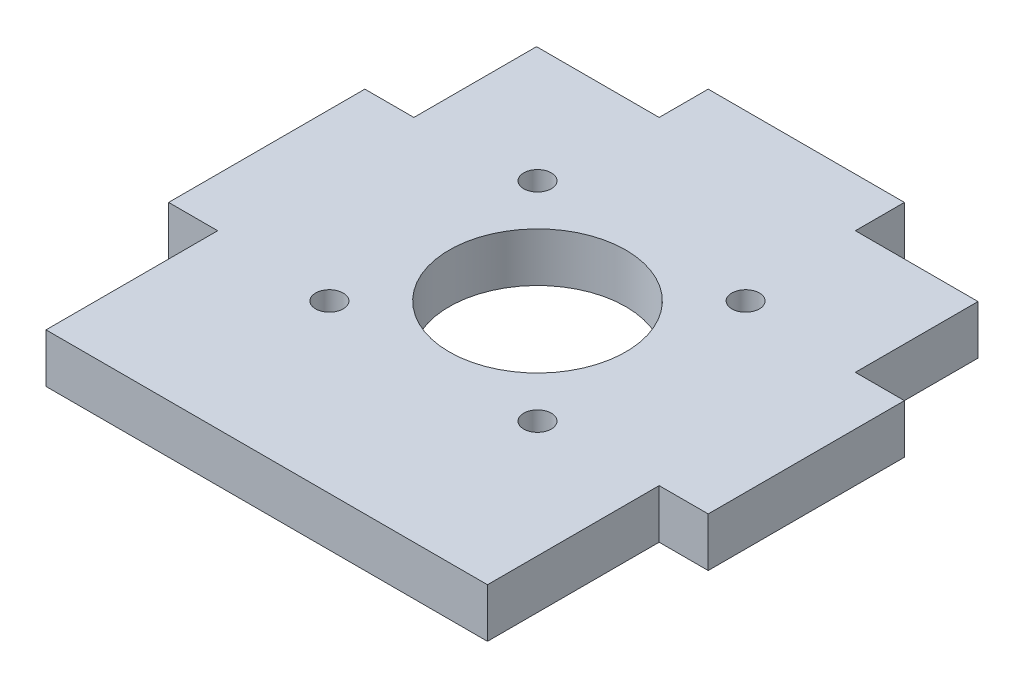
from build123d import *

# Parameters (mm, degrees)
SKETCH1_R      = 11.43
SKETCH1_R_2    = 1.7859375
EXTRUDE1_DEPTH = 6.35


with BuildPart() as part:
    # Sketch1 → Extrude1 (new body)
    with BuildSketch(Plane(origin=(0, 0, 0), x_dir=(1, 0, 0), z_dir=(0, 1, 0))):
        Polygon((6.35, 47.625), (0, 47.625), (0, 22.225), (6.35, 22.225), (6.35, 0), (63.5, 0), (63.5, 22.225), (69.85, 22.225), (69.85, 47.625), (63.5, 47.625), (63.5, 63.5), (47.625, 63.5), (47.625, 69.85), (22.225, 69.85), (22.225, 63.5), (6.35, 63.5), align=None)
        with Locations(Location((34.925, 35.052, 0), (0, 0, 270))):
            Circle(SKETCH1_R, mode=Mode.SUBTRACT)
        with Locations(Location((21.454615818, 48.522384182, 0), (0, 0, 270))):
            Circle(SKETCH1_R_2, mode=Mode.SUBTRACT)
        with Locations(Location((48.395384182, 48.522384182, 0), (0, 0, 270))):
            Circle(SKETCH1_R_2, mode=Mode.SUBTRACT)
        with Locations(Location((48.395384182, 21.581615818, 0), (0, 0, 270))):
            Circle(SKETCH1_R_2, mode=Mode.SUBTRACT)
        with Locations(Location((21.454615818, 21.581615818, 0), (0, 0, 270))):
            Circle(SKETCH1_R_2, mode=Mode.SUBTRACT)
    extrude(amount=EXTRUDE1_DEPTH)


solid = part.part
